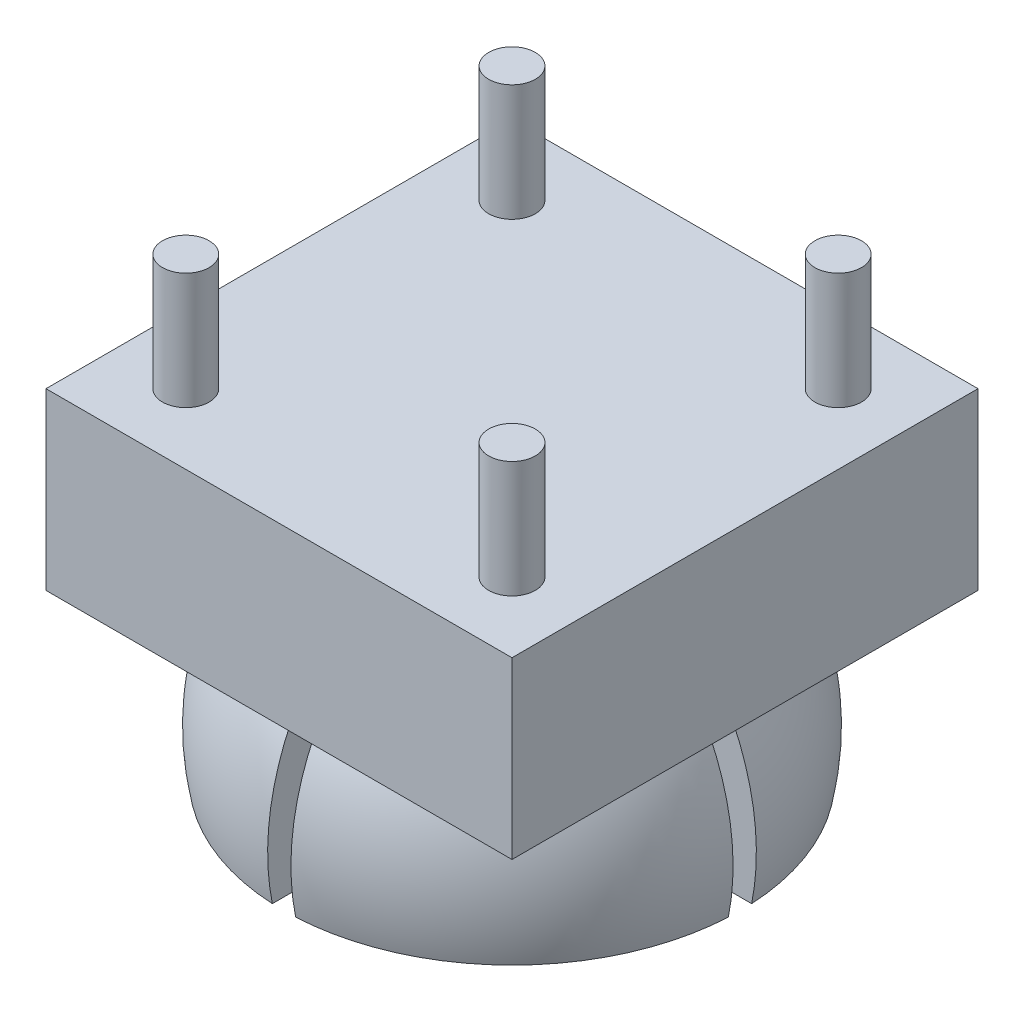
from build123d import *

# Parameters (mm, degrees)
SKETCH1_W               = 20
SKETCH1_H               = 20
BOSS_EXTRUDE1_DEPTH     = 7.5
SKETCH6_W               = 20
SKETCH6_H               = 20
CUT_EXTRUDE1_DEPTH      = 8
SKETCH8_R               = 1
BOSS_EXTRUDE3_DEPTH     = 5
CUT_EXTRUDE2_DEPTH      = 0.5
CUT_EXTRUDE2_DEPTH_BACK = 0.5
SKETCH9_W               = 20
SKETCH9_H               = 7
CUT_EXTRUDE3_DEPTH      = 0.5
CUT_EXTRUDE3_DEPTH_BACK = 0.5
SKETCH10_W              = 20
SKETCH10_H              = 7


with BuildPart() as part:
    # Sketch1 → Boss-Extrude1 (new body)
    with BuildSketch(Plane(origin=(0, 0, 0), x_dir=(1, 0, 0), z_dir=(0, 1, 0))):
        with Locations((4.807692308, 6.842948718)):
            Rectangle(SKETCH1_W, SKETCH1_H)
    extrude(amount=BOSS_EXTRUDE1_DEPTH)

    # Sketch3 → Cut-Revolve3 (revolve, cut)
    with BuildSketch(Plane.XY.offset(-6.842948718)):
        with BuildLine():
            ThreePointArc((4.807692308, -13), (12.807692308, -5), (4.807692308, 3))
            Line((4.807692308, 3), (4.807692308, -13))
        make_face()
    revolve(axis=Axis((4.807692308, 5, -6.842948718), (0, -1, 0)), mode=Mode.SUBTRACT)

    # Sketch5 → Revolve7 (revolve)
    with BuildSketch(Plane.XY.offset(-6.842948718)):
        with BuildLine():
            ThreePointArc((4.807692308, -13), (12.807692308, -5), (4.807692308, 3))
            Line((4.807692308, 3), (4.807692308, 5))
            ThreePointArc((4.807692308, 5), (14.807692308, -5), (4.807692308, -15))
            Line((4.807692308, -15), (4.807692308, -13))
        make_face()
    revolve(axis=Axis((4.807692308, 5, -6.842948718), (0, -1, 0)))

    # Sketch6 → Cut-Extrude1 (cut)
    with BuildSketch(Plane(origin=(0, -15, 0), x_dir=(-1, 0, 0), z_dir=(0, -1, 0))):
        with Locations((-4.807692308, 6.842948718)):
            Rectangle(SKETCH6_W, SKETCH6_H)
    extrude(amount=-CUT_EXTRUDE1_DEPTH, mode=Mode.SUBTRACT)

    # Sketch8 → Boss-Extrude3 (add)
    with BuildSketch(Plane(origin=(0, 7.5, 0), x_dir=(1, 0, 0), z_dir=(0, 1, 0))):
        with Locations(Location((-2.192307692, -0.157051282, 0), (0, 0, 90))):
            Circle(SKETCH8_R)
        with Locations(Location((-2.192307692, 13.842948718, 0), (0, 0, 90))):
            Circle(SKETCH8_R)
        with Locations(Location((11.807692308, -0.157051282, 0), (0, 0, 90))):
            Circle(SKETCH8_R)
        with Locations(Location((11.807692308, 13.842948718, 0), (0, 0, 90))):
            Circle(SKETCH8_R)
    extrude(amount=BOSS_EXTRUDE3_DEPTH)

    # Sketch9 → Cut-Extrude2 (cut, two sides: drawn at the far end of the back side and taken through both)
    with BuildSketch(Plane.XY.offset(-6.842948718).offset(-CUT_EXTRUDE2_DEPTH_BACK)):
        with Locations((4.807692308, -3.5)):
            Rectangle(SKETCH9_W, SKETCH9_H)
    extrude(amount=CUT_EXTRUDE2_DEPTH + CUT_EXTRUDE2_DEPTH_BACK, mode=Mode.SUBTRACT)


with BuildPart() as cut_extrude2_kept_piece:
    # of the separate pieces the step leaves, the one the design keeps (cut_extrude2_pieces_kept)
    add(part.part.solids().sort_by_distance((-5.192307692, 0, 3.157051282))[0])

    # Sketch10 → Cut-Extrude3 (cut, two sides: drawn at the far end of the back side and taken through both)
    with BuildSketch(Plane.ZY.offset(-4.807692308).offset(-CUT_EXTRUDE3_DEPTH_BACK)):
        with Locations((-6.842948718, -3.5)):
            Rectangle(SKETCH10_W, SKETCH10_H)
    extrude(amount=CUT_EXTRUDE3_DEPTH + CUT_EXTRUDE3_DEPTH_BACK, mode=Mode.SUBTRACT)


with BuildPart() as cut_extrude3_kept_piece:
    # of the separate pieces the step leaves, the one the design keeps (cut_extrude3_pieces_kept)
    add(cut_extrude2_kept_piece.part.solids().sort_by_distance((-5.192307692, 0, 3.157051282))[0])


solid = cut_extrude3_kept_piece.part
